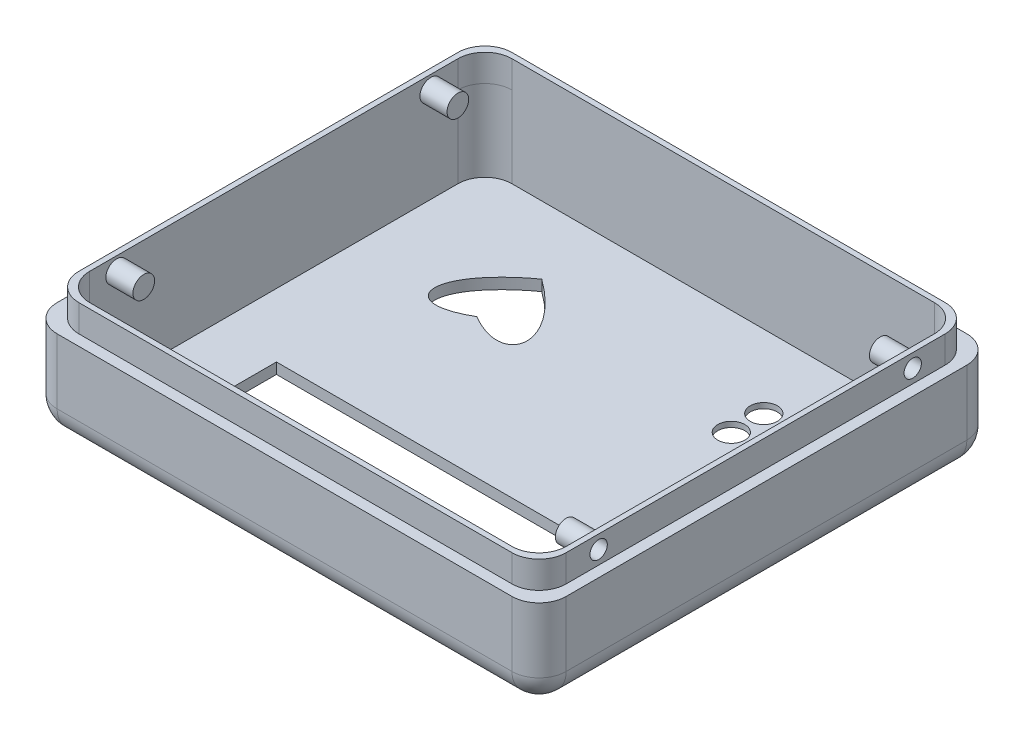
from build123d import *

# Parameters (mm, degrees)
SKETCH1_W           = 94
SKETCH1_H           = 84
BOSS_EXTRUDE1_DEPTH = 17
SKETCH2_W           = 88
SKETCH2_H           = 78
CUT_EXTRUDE1_DEPTH  = 15
FILLET1_R           = 5
SKETCH4_W           = 90
SKETCH4_H           = 80
BOSS_EXTRUDE3_DEPTH = 5
SKETCH5_W           = 88
SKETCH5_H           = 78
CUT_EXTRUDE2_DEPTH  = 5
FILLET2_R           = 5
SKETCH6_R           = 2
BOSS_EXTRUDE4_DEPTH = 5
BOSS_EXTRUDE5_START = 5
SKETCH7_R           = 2
BOSS_EXTRUDE5_DEPTH = 5
SKETCH8_R           = 1.6
CUT_EXTRUDE3_DEPTH  = 4
CUT_EXTRUDE4_START  = -4
SKETCH9_R           = 1.6
CUT_EXTRUDE4_DEPTH  = 4
SKETCH10_W          = 64.5
SKETCH10_H          = 14.5
CUT_EXTRUDE5_DEPTH  = 2
SKETCH11_W          = 9
SKETCH11_H          = 20
CUT_EXTRUDE6_DEPTH  = 1
FILLET3_R           = 1
SKETCH12_R          = 2.5
CUT_EXTRUDE7_DEPTH  = 1
CUT_EXTRUDE8_DEPTH  = 2


with BuildPart() as part:
    # Sketch1 → Boss-Extrude1 (new body)
    with BuildSketch(Plane(origin=(0, 0, 0), x_dir=(1, 0, 0), z_dir=(0, 1, 0))):
        Rectangle(SKETCH1_W, SKETCH1_H)
    extrude(amount=BOSS_EXTRUDE1_DEPTH)

    # Sketch2 → Cut-Extrude1 (cut)
    with BuildSketch(Plane(origin=(0, 17, 0), x_dir=(1, 0, 0), z_dir=(0, 1, 0))):
        Rectangle(SKETCH2_W, SKETCH2_H)
    extrude(amount=-CUT_EXTRUDE1_DEPTH, mode=Mode.SUBTRACT)

    # Fillet1
    fillet1_edges = [part.edges().sort_by_distance(p)[0] for p in [
        (44, 9.5, -39),
        (44, 9.5, 39),
        (-44, 9.5, 39),
        (-44, 9.5, -39),
        (0, 0, 42),
        (-47, 0, 0),
        (0, 0, -42),
        (47, 0, 0),
        (47, 8.5, 42),
        (-47, 8.5, 42),
        (-47, 8.5, -42),
        (47, 8.5, -42),
    ]]
    fillet(fillet1_edges, radius=FILLET1_R)

    # Sketch4 → Boss-Extrude3 (add)
    with BuildSketch(Plane(origin=(0, 17, 0), x_dir=(1, 0, 0), z_dir=(0, 1, 0))):
        Rectangle(SKETCH4_W, SKETCH4_H)
    extrude(amount=BOSS_EXTRUDE3_DEPTH)

    # Sketch5 → Cut-Extrude2 (cut)
    with BuildSketch(Plane(origin=(0, 22, 0), x_dir=(1, 0, 0), z_dir=(0, 1, 0))):
        Rectangle(SKETCH5_W, SKETCH5_H)
    extrude(amount=-CUT_EXTRUDE2_DEPTH, mode=Mode.SUBTRACT)

    # Fillet2
    fillet2_edges = [part.edges().sort_by_distance(p)[0] for p in [
        (44, 19.5, 39),
        (-44, 19.5, -39),
        (-44, 19.5, 39),
        (44, 19.5, -39),
        (45, 19.5, -40),
        (-45, 19.5, -40),
        (-45, 19.5, 40),
        (45, 19.5, 40),
    ]]
    fillet(fillet2_edges, radius=FILLET2_R)

    # Sketch6 → Boss-Extrude4 (add)
    with BuildSketch(Plane(origin=(-44, 0, 0), x_dir=(0, 0, -1), z_dir=(1, 0, 0))):
        with Locations(Location((29, 19.5, 0), (0, 0, 180))):
            Circle(SKETCH6_R)
        with Locations(Location((-29, 19.5, 0), (0, 0, 180))):
            Circle(SKETCH6_R)
    extrude(amount=BOSS_EXTRUDE4_DEPTH)

    # Sketch7 → Boss-Extrude5 (add)
    with BuildSketch(Plane.ZY.offset(-44).offset(BOSS_EXTRUDE5_START)):
        with Locations((29, 19.5)):
            Circle(SKETCH7_R)
        with Locations((-29, 19.5)):
            Circle(SKETCH7_R)
    extrude(amount=-BOSS_EXTRUDE5_DEPTH)

    # Sketch8 → Cut-Extrude3 (cut)
    with BuildSketch(Plane(origin=(45, 0, 0), x_dir=(0, 0, -1), z_dir=(1, 0, 0))):
        with Locations((29, 19.5)):
            Circle(SKETCH8_R)
        with Locations((-29, 19.5)):
            Circle(SKETCH8_R)
    extrude(amount=-CUT_EXTRUDE3_DEPTH, mode=Mode.SUBTRACT)

    # Sketch9 → Cut-Extrude4 (cut)
    with BuildSketch(Plane.ZY.offset(45).offset(CUT_EXTRUDE4_START)):
        with Locations(Location((-29, 19.5, 0), (0, 0, 180))):
            Circle(SKETCH9_R)
        with Locations(Location((29, 19.5, 0), (0, 0, 180))):
            Circle(SKETCH9_R)
    extrude(amount=CUT_EXTRUDE4_DEPTH, mode=Mode.SUBTRACT)

    # Sketch10 → Cut-Extrude5 (cut)
    with BuildSketch(Plane.XZ):
        with Locations((0, 18.5)):
            Rectangle(SKETCH10_W, SKETCH10_H)
    extrude(amount=-CUT_EXTRUDE5_DEPTH, mode=Mode.SUBTRACT)

    # Sketch11 → Cut-Extrude6 (cut)
    with BuildSketch(Plane.XZ):
        with Locations((21, -22.5)):
            Rectangle(SKETCH11_W, SKETCH11_H)
    extrude(amount=-CUT_EXTRUDE6_DEPTH, mode=Mode.SUBTRACT)

    # Fillet3
    fillet3_edges = [part.edges().sort_by_distance(p)[0] for p in [
        (25.5, 0.5, -12.5),
        (25.5, 0.5, -32.5),
        (16.5, 0.5, -32.5),
        (16.5, 0.5, -12.5),
    ]]
    fillet(fillet3_edges, radius=FILLET3_R)

    # Sketch12 → Cut-Extrude7 (cut)
    with BuildSketch(Plane.XZ.offset(-1)):
        with Locations(Location((21, -19.5, 0), (0, 0, 270))):
            Circle(SKETCH12_R)
        with Locations(Location((21, -25.5, 0), (0, 0, 270))):
            Circle(SKETCH12_R)
    extrude(amount=-CUT_EXTRUDE7_DEPTH, mode=Mode.SUBTRACT)

    # Sketch14 → Cut-Extrude8 (cut)
    with BuildSketch(Plane.XZ):
        with BuildLine():
            add(Edge.make_bspline(
                [(-21, -14.5), (-31.13838967, -8.574048951), (-33.509816714, -17.373555981), (-21, -26.5)],
                knots=[0, 0, 0, 0, 1, 1, 1, 1], degree=3))
            add(Edge.make_bspline(
                [(-21, -14.5), (-10.86161033, -8.574048951), (-8.490183286, -17.373555981), (-21, -26.5)],
                knots=[0, 0, 0, 0, 1, 1, 1, 1], degree=3))
        make_face()
    extrude(amount=-CUT_EXTRUDE8_DEPTH, mode=Mode.SUBTRACT)


solid = part.part
